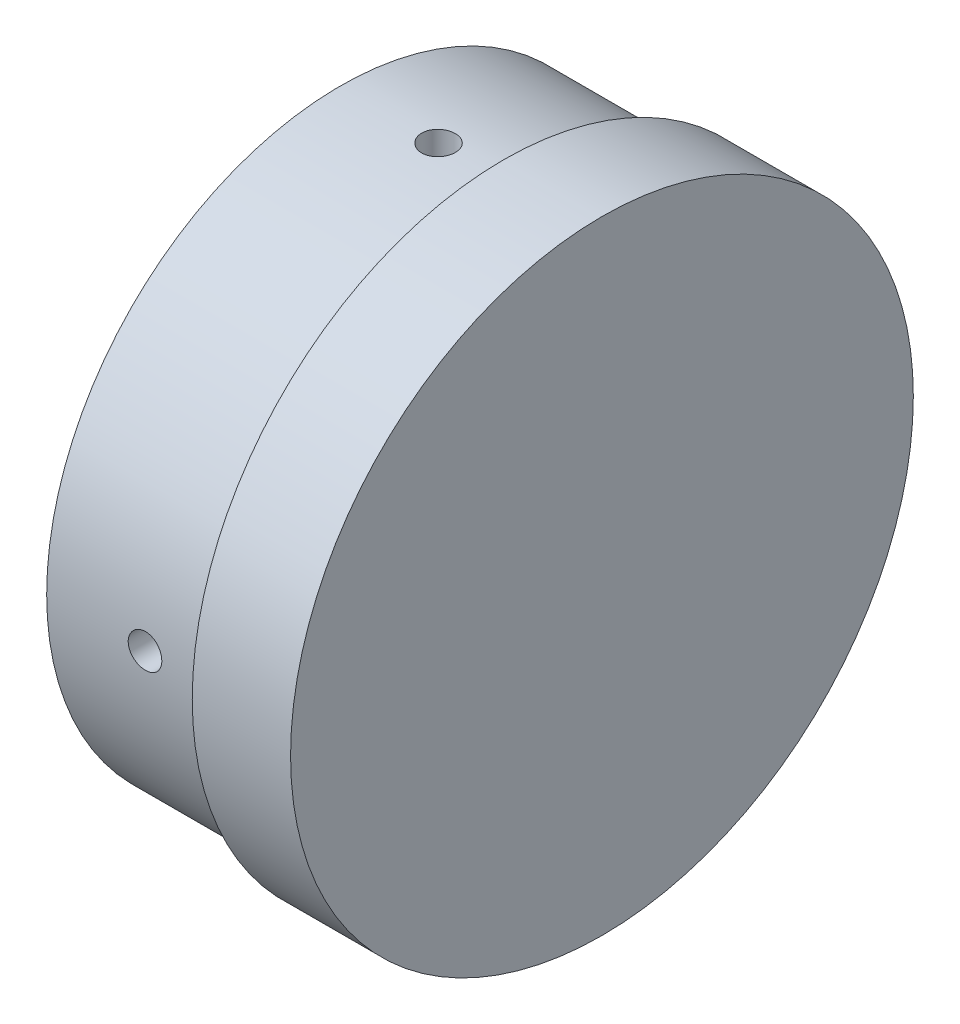
from build123d import *

# Parameters (mm, degrees)
M2_5_TAPPED_HOLE1_D               = 2.05
M2_5_TAPPED_HOLE1_DEPTH           = 4
M2_5_TAPPED_HOLE1_TIP             = 0.615882135
M2_5_TAPPED_HOLE1_ON_FACE_2_D     = 2.05
M2_5_TAPPED_HOLE1_ON_FACE_2_DEPTH = 4
M2_5_TAPPED_HOLE1_ON_FACE_2_TIP   = 0.615882135
M2_5_TAPPED_HOLE1_ON_FACE_3_D     = 2.05
M2_5_TAPPED_HOLE1_ON_FACE_3_DEPTH = 4
M2_5_TAPPED_HOLE1_ON_FACE_3_TIP   = 0.615882135
M2_5_TAPPED_HOLE2_D               = 2.05
M2_5_TAPPED_HOLE2_DEPTH           = 4.9
M2_5_TAPPED_HOLE2_TIP             = 0.615882135
M2_5_TAPPED_HOLE2_ON_FACE_2_D     = 2.05
M2_5_TAPPED_HOLE2_ON_FACE_2_DEPTH = 4.9
M2_5_TAPPED_HOLE2_ON_FACE_2_TIP   = 0.615882135


with BuildPart() as part:
    # Sketch1 → Revolve1 (revolve)
    with BuildSketch(Plane.XY, mode=Mode.PRIVATE) as revolve1_sk:
        Polygon((0, 17.8825346), (0, 0), (15.97, 0), (15.97, 17), (15.97, 19), (9.97, 19), (9.97, 17.9125346), (0, 17.9125346), align=None)
    revolve(revolve1_sk.sketch.rotate(Axis((-76.24269061, 0, 0), (1, 0, 0)), 90), axis=Axis((-76.24269061, 0, 0), (1, 0, 0)))

    # M2.5 Tapped Hole1
    with Locations(Plane(origin=(6, -17.9125346, 0), x_dir=(0, 0, -1), z_dir=(0, -1, 0))):
        with Locations((0, 0)):
            Hole(M2_5_TAPPED_HOLE1_D / 2, depth=M2_5_TAPPED_HOLE1_DEPTH)
            with Locations((0, 0, -(M2_5_TAPPED_HOLE1_DEPTH + M2_5_TAPPED_HOLE1_TIP / 2))):  # 118° drill point
                Cone(0, M2_5_TAPPED_HOLE1_D / 2, M2_5_TAPPED_HOLE1_TIP, mode=Mode.SUBTRACT)

    # M2.5 Tapped Hole1 on face 2
    with Locations(Plane(origin=(6, 0, 17.9125346), x_dir=(1, 0, 0), z_dir=(0, 0, 1))):
        with Locations((0, 0)):
            Hole(M2_5_TAPPED_HOLE1_ON_FACE_2_D / 2, depth=M2_5_TAPPED_HOLE1_ON_FACE_2_DEPTH)
            with Locations((0, 0, -(M2_5_TAPPED_HOLE1_ON_FACE_2_DEPTH + M2_5_TAPPED_HOLE1_ON_FACE_2_TIP / 2))):  # 118° drill point
                Cone(0, M2_5_TAPPED_HOLE1_ON_FACE_2_D / 2, M2_5_TAPPED_HOLE1_ON_FACE_2_TIP, mode=Mode.SUBTRACT)

    # M2.5 Tapped Hole1 on face 3
    with Locations(Plane(origin=(-38.298616193, 0, -8.034883706), x_dir=(0, 0, -1), z_dir=(0, -1, 0))):
        with Locations((0, 0)):
            Hole(M2_5_TAPPED_HOLE1_ON_FACE_3_D / 2, depth=M2_5_TAPPED_HOLE1_ON_FACE_3_DEPTH)
            with Locations((0, 0, -(M2_5_TAPPED_HOLE1_ON_FACE_3_DEPTH + M2_5_TAPPED_HOLE1_ON_FACE_3_TIP / 2))):  # 118° drill point
                Cone(0, M2_5_TAPPED_HOLE1_ON_FACE_3_D / 2, M2_5_TAPPED_HOLE1_ON_FACE_3_TIP, mode=Mode.SUBTRACT)

    # M2.5 Tapped Hole2
    with Locations(Plane(origin=(6, 0, -17.9125346), x_dir=(0, -1, 0), z_dir=(0, 0, -1))):
        with Locations((0, 0)):
            Hole(M2_5_TAPPED_HOLE2_D / 2, depth=M2_5_TAPPED_HOLE2_DEPTH)
            with Locations((0, 0, -(M2_5_TAPPED_HOLE2_DEPTH + M2_5_TAPPED_HOLE2_TIP / 2))):  # 118° drill point
                Cone(0, M2_5_TAPPED_HOLE2_D / 2, M2_5_TAPPED_HOLE2_TIP, mode=Mode.SUBTRACT)

    # M2.5 Tapped Hole2 on face 2
    with Locations(Plane(origin=(6, 17.9125346, 0), x_dir=(0, 0, 1), z_dir=(0, 1, 0))):
        with Locations((0, 0)):
            Hole(M2_5_TAPPED_HOLE2_ON_FACE_2_D / 2, depth=M2_5_TAPPED_HOLE2_ON_FACE_2_DEPTH)
            with Locations((0, 0, -(M2_5_TAPPED_HOLE2_ON_FACE_2_DEPTH + M2_5_TAPPED_HOLE2_ON_FACE_2_TIP / 2))):  # 118° drill point
                Cone(0, M2_5_TAPPED_HOLE2_ON_FACE_2_D / 2, M2_5_TAPPED_HOLE2_ON_FACE_2_TIP, mode=Mode.SUBTRACT)


solid = part.part
